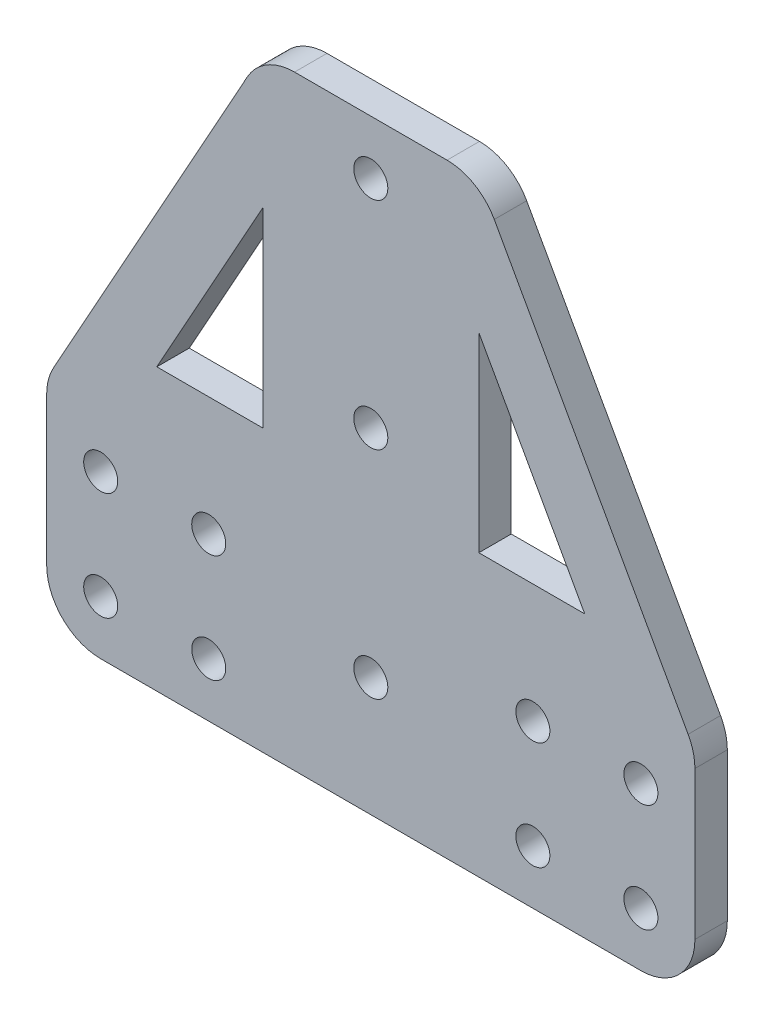
from build123d import *

# Parameters (mm, degrees)
EXTRUDE_1_DEPTH     = 3
SKETCH_2_R          = 1.575
CUT_EXTRUDE_1_DEPTH = 69.883960397
FILLET_1_R          = 5


with BuildPart() as part:
    # 草图1 → 凸台-拉伸1 (new body)
    with BuildSketch(Plane.XY):
        Polygon((0, 0), (20, 0), (40, -36), (40, -56), (-20, -56), (-20, -36), align=None)
    extrude(amount=EXTRUDE_1_DEPTH)

    # 草图2 → 切除-拉伸1 (cut, through all)
    with BuildSketch(Plane.XY.offset(3)):
        with Locations((-15, -41)):
            Circle(SKETCH_2_R)
        with Locations(Location((-5, -41, 0), (0, 0, 180))):
            Circle(SKETCH_2_R)
        with Locations((-5, -51)):
            Circle(SKETCH_2_R)
        with Locations(Location((-15, -51, 0), (0, 0, 180))):
            Circle(SKETCH_2_R)
        with Locations((35, -51)):
            Circle(SKETCH_2_R)
        with Locations(Location((25, -51, 0), (0, 0, 180))):
            Circle(SKETCH_2_R)
        with Locations((25, -41)):
            Circle(SKETCH_2_R)
        with Locations(Location((35, -41, 0), (0, 0, 180))):
            Circle(SKETCH_2_R)
        with Locations((10, -25)):
            Circle(SKETCH_2_R)
        with Locations((10, -5)):
            Circle(SKETCH_2_R)
        with Locations((10, -45)):
            Circle(SKETCH_2_R)
        Polygon((0, -12.354756169), (-9.802913239, -30), (0, -30), align=None)
        Polygon((29.802913239, -30), (20, -30), (20, -12.354756169), align=None)
    extrude(amount=-CUT_EXTRUDE_1_DEPTH, mode=Mode.SUBTRACT)

    # 圆角1
    fillet_1_edges = [part.edges().sort_by_distance(p)[0] for p in [
        (0, 0, 1.5),
        (20, 0, 1.5),
        (40, -36, 1.5),
        (40, -56, 1.5),
        (-20, -56, 1.5),
        (-20, -36, 1.5),
    ]]
    fillet(fillet_1_edges, radius=FILLET_1_R)


solid = part.part
